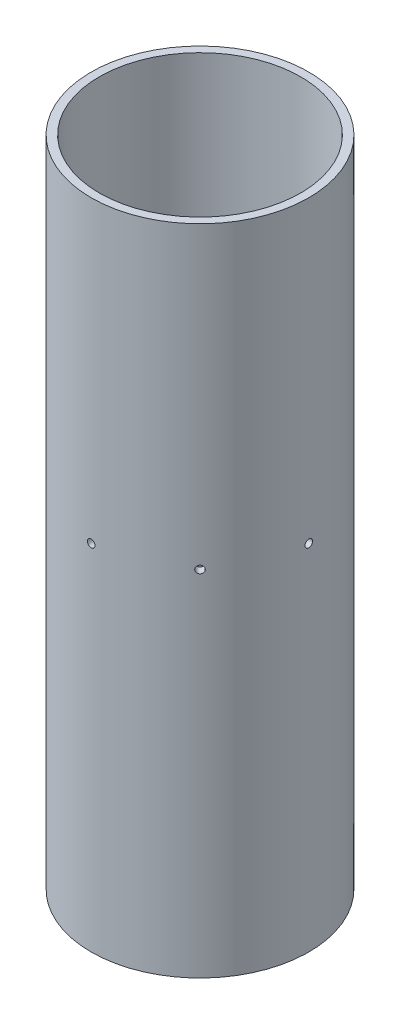
from build123d import *

# Parameters (mm, degrees)
SKETCH2_R                 = 50.8
SKETCH2_R_2               = 46.99
COUPLER_EXTRUSION_DEPTH   = 304.8
BULKHEAD_HOLES_REACH      = 327.279
BULKHEAD_HOLES_END_RADIUS = 46.99
SKETCH3_R                 = 1.7526
CIRPATTERN1_COUNT         = 8


with BuildPart() as part:
    # Sketch2 → Coupler Extrusion (new body)
    with BuildSketch(Plane(origin=(0, 0, 0), x_dir=(1, 0, 0), z_dir=(0, 1, 0))):
        with Locations(Location((0, 0, 0), (0, 0, 90))):
            Circle(SKETCH2_R)
        with Locations(Location((0, 0, 0), (0, 0, 90))):
            Circle(SKETCH2_R_2, mode=Mode.SUBTRACT)
    extrude(amount=COUPLER_EXTRUSION_DEPTH)

    # Bulkhead Holes: up to this cylinder (the profile starts outside it)
    bulkhead_holes_end = Plane(origin=(0, 165.1, 0), z_dir=(0, -1, 0)) * Cylinder(BULKHEAD_HOLES_END_RADIUS, 749.538, mode=Mode.PRIVATE)
    # Sketch3 → Bulkhead Holes (cut, up to the surface)
    with BuildSketch(Plane.XY.offset(50.8), mode=Mode.PRIVATE) as bulkhead_holes_sk1:
        with Locations((0, 165.1)):
            Circle(SKETCH3_R)
    bulkhead_holes_tool1 = extrude(bulkhead_holes_sk1.sketch, amount=-BULKHEAD_HOLES_REACH, mode=Mode.PRIVATE) - bulkhead_holes_end
    bulkhead_holes = bulkhead_holes_tool1.solids().sort_by_distance((0, 165.1, 50.8))[0]
    add(bulkhead_holes, mode=Mode.SUBTRACT)

    # CirPattern1: Bulkhead Holes ×8 about axis
    cirpattern1_axis = Axis((0, 304.8, 0), (0, -1, 0))
    for i in range(1, CIRPATTERN1_COUNT):
        add(bulkhead_holes.rotate(cirpattern1_axis, i * 360 / CIRPATTERN1_COUNT), mode=Mode.SUBTRACT)


solid = part.part
